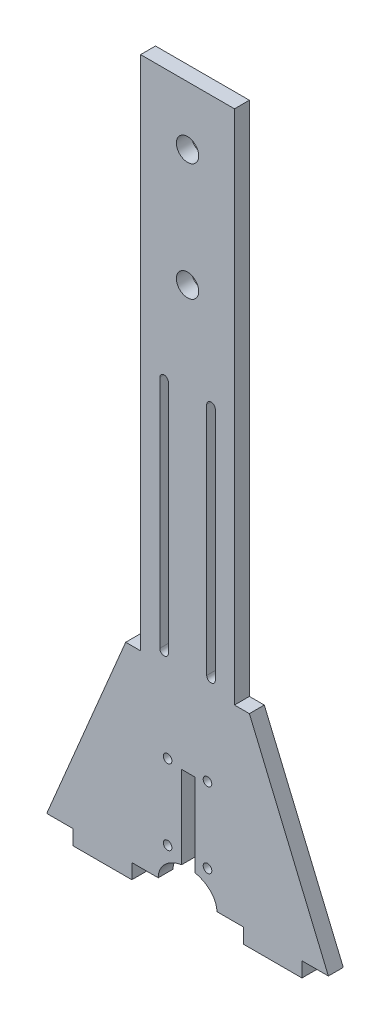
from build123d import *

# Parameters (mm, degrees)
BOSS_EXTRU_1_DEPTH      = 3.175
SKETCH1_R               = 4.7625
CUT_EXTRUDE1_DEPTH      = 6.35
ENL_V_MAT_EXTRU_1_DEPTH = 6.35
ESQUISSE3_W             = 5.715
ESQUISSE3_H             = 45
ENL_V_MAT_EXTRU_2_DEPTH = 6.35
ENL_V_MAT_EXTRU_3_REACH = 308.007
ESQUISSE5_R             = 1.83
ENL_V_MAT_EXTRU_4_REACH = 308.007
SKETCH3_W               = 25
SKETCH3_H               = 6.35
BOSS_EXTRUDE2_DEPTH     = 6.35


with BuildPart() as part:
    # Esquisse1 → Boss.-Extru.1 (new, symmetric)
    with BuildSketch(Plane.XY):
        Polygon((-20, 300), (20, 300), (20, 80), (26.35, 80), (60, 0), (-60, 0), (-26.35, 80), (-20, 80), align=None)
    extrude(amount=BOSS_EXTRU_1_DEPTH, both=True)

    # Sketch1 → Cut-Extrude1 (cut)
    with BuildSketch(Plane.XY.offset(3.175)):
        with Locations((0, 275)):
            Circle(SKETCH1_R)
        with Locations((0, 225)):
            Circle(SKETCH1_R)
    extrude(amount=-CUT_EXTRUDE1_DEPTH, mode=Mode.SUBTRACT)

    # Esquisse2 → Enlèv. mat.-Extru.1 (cut)
    with BuildSketch(Plane.XY.offset(3.175)):
        with BuildLine():
            Line((-12.5, 0), (12.5, 0))
            add(Edge.make_bspline(
                [(12.5, 0), (12.5, 10), (0, 10), (-12.5, 10), (-12.5, 0)],
                knots=[0, 0, 0, 1.570796327, 1.570796327, 3.141592654, 3.141592654, 3.141592654], degree=2, weights=[1, 0.707106781, 1, 0.707106781, 1]))
        make_face()
    extrude(amount=-ENL_V_MAT_EXTRU_1_DEPTH, mode=Mode.SUBTRACT)

    # Esquisse3 → Enlèv. mat.-Extru.2 (cut)
    with BuildSketch(Plane.XY.offset(3.175)):
        with Locations((0.3175, 22.5)):
            Rectangle(ESQUISSE3_W, ESQUISSE3_H)
    extrude(amount=-ENL_V_MAT_EXTRU_2_DEPTH, mode=Mode.SUBTRACT)

    # Esquisse5 → Enlèv. mat.-Extru.3 (cut, up to next)
    with BuildSketch(Plane(origin=(0, 0, -3.175), x_dir=(-1, 0, 0), z_dir=(0, 0, -1)), mode=Mode.PRIVATE) as enl_v_mat_extru_3_sk1:
        with Locations((-8.5, 46)):
            Circle(ESQUISSE5_R)
    enl_v_mat_extru_3_tool1 = extrude(enl_v_mat_extru_3_sk1.sketch, amount=-ENL_V_MAT_EXTRU_3_REACH, mode=Mode.PRIVATE) & part.part
    # Esquisse5 → Enlèv. mat.-Extru.3 (cut, up to next)
    with BuildSketch(Plane(origin=(0, 0, -3.175), x_dir=(-1, 0, 0), z_dir=(0, 0, -1)), mode=Mode.PRIVATE) as enl_v_mat_extru_3_sk2:
        with Locations((8.5, 46)):
            Circle(ESQUISSE5_R)
    enl_v_mat_extru_3_tool2 = extrude(enl_v_mat_extru_3_sk2.sketch, amount=-ENL_V_MAT_EXTRU_3_REACH, mode=Mode.PRIVATE) & part.part
    # Esquisse5 → Enlèv. mat.-Extru.3 (cut, up to next)
    with BuildSketch(Plane(origin=(0, 0, -3.175), x_dir=(-1, 0, 0), z_dir=(0, 0, -1)), mode=Mode.PRIVATE) as enl_v_mat_extru_3_sk3:
        with Locations((8.5, 14)):
            Circle(ESQUISSE5_R)
    enl_v_mat_extru_3_tool3 = extrude(enl_v_mat_extru_3_sk3.sketch, amount=-ENL_V_MAT_EXTRU_3_REACH, mode=Mode.PRIVATE) & part.part
    # Esquisse5 → Enlèv. mat.-Extru.3 (cut, up to next)
    with BuildSketch(Plane(origin=(0, 0, -3.175), x_dir=(-1, 0, 0), z_dir=(0, 0, -1)), mode=Mode.PRIVATE) as enl_v_mat_extru_3_sk4:
        with Locations((-8.5, 14)):
            Circle(ESQUISSE5_R)
    enl_v_mat_extru_3_tool4 = extrude(enl_v_mat_extru_3_sk4.sketch, amount=-ENL_V_MAT_EXTRU_3_REACH, mode=Mode.PRIVATE) & part.part
    add(enl_v_mat_extru_3_tool1.solids().sort_by_distance((8.5, 46, -3.175))[0], mode=Mode.SUBTRACT)
    add(enl_v_mat_extru_3_tool2.solids().sort_by_distance((-8.5, 46, -3.175))[0], mode=Mode.SUBTRACT)
    add(enl_v_mat_extru_3_tool3.solids().sort_by_distance((-8.5, 14, -3.175))[0], mode=Mode.SUBTRACT)
    add(enl_v_mat_extru_3_tool4.solids().sort_by_distance((8.5, 14, -3.175))[0], mode=Mode.SUBTRACT)

    # Esquisse6 → Enlèv. mat.-Extru.4 (cut, up to next)
    with BuildSketch(Plane.XY.offset(3.175), mode=Mode.PRIVATE) as enl_v_mat_extru_4_sk1:
        with BuildLine():
            Line((-11.835, 185), (-11.835, 85))
            ThreePointArc((-11.835, 85), (-10, 83.165), (-8.165, 85))
            Line((-8.165, 85), (-8.165, 185))
            ThreePointArc((-8.165, 185), (-10, 186.835), (-11.835, 185))
        make_face()
    enl_v_mat_extru_4_tool1 = extrude(enl_v_mat_extru_4_sk1.sketch, amount=-ENL_V_MAT_EXTRU_4_REACH, mode=Mode.PRIVATE) & part.part
    # Esquisse6 → Enlèv. mat.-Extru.4 (cut, up to next)
    with BuildSketch(Plane.XY.offset(3.175), mode=Mode.PRIVATE) as enl_v_mat_extru_4_sk2:
        with BuildLine():
            Line((11.835, 185), (11.835, 85))
            ThreePointArc((11.835, 85), (10, 83.165), (8.165, 85))
            Line((8.165, 85), (8.165, 185))
            ThreePointArc((8.165, 185), (10, 186.835), (11.835, 185))
        make_face()
    enl_v_mat_extru_4_tool2 = extrude(enl_v_mat_extru_4_sk2.sketch, amount=-ENL_V_MAT_EXTRU_4_REACH, mode=Mode.PRIVATE) & part.part
    add(enl_v_mat_extru_4_tool1.solids().sort_by_distance((-10, 135, 3.175))[0], mode=Mode.SUBTRACT)
    add(enl_v_mat_extru_4_tool2.solids().sort_by_distance((10, 135, 3.175))[0], mode=Mode.SUBTRACT)

    # Sketch3 → Boss-Extrude2 (add)
    with BuildSketch(Plane(origin=(0, 0, 0), x_dir=(-1, 0, 0), z_dir=(0, -1, 0))):
        with Locations((-36.25, 0)):
            Rectangle(SKETCH3_W, SKETCH3_H)
        with Locations((36.25, 0)):
            Rectangle(SKETCH3_W, SKETCH3_H)
    extrude(amount=BOSS_EXTRUDE2_DEPTH)


solid = part.part
